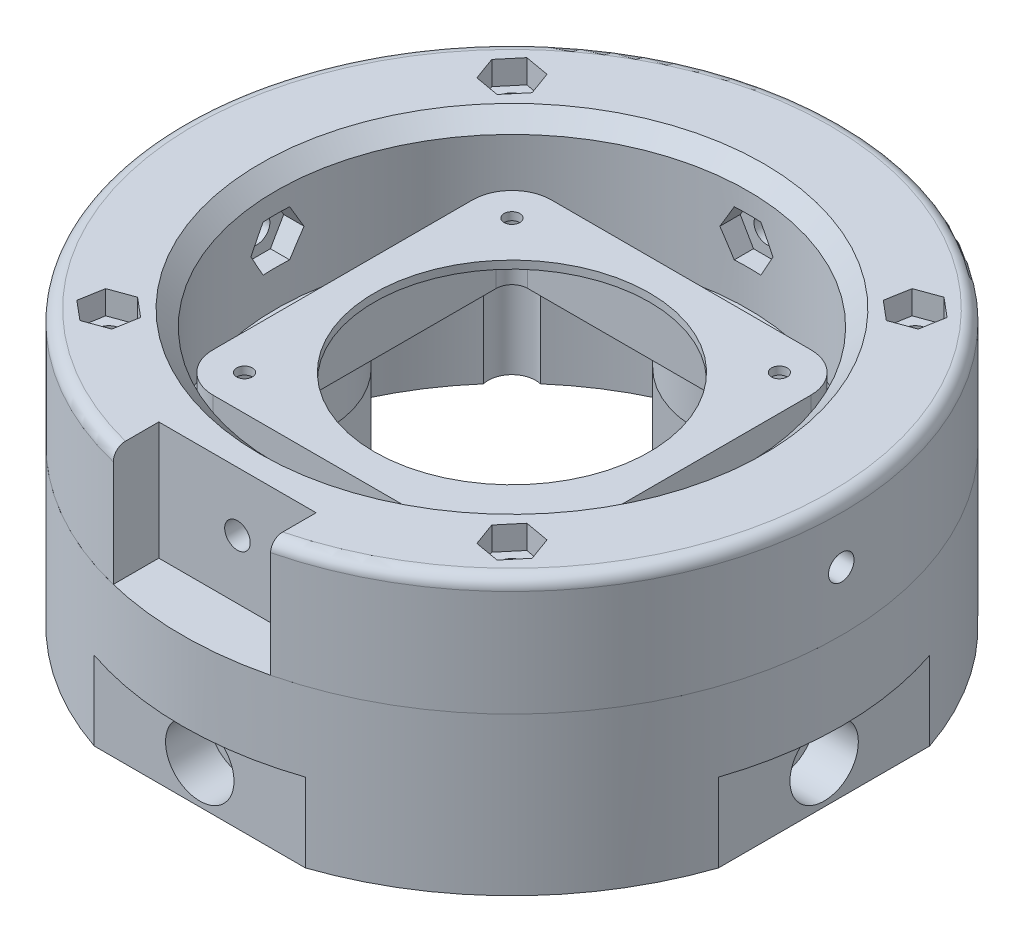
from build123d import *
from build123d.topology import SkipClean

# Parameters (mm, degrees)
SKETCH1_R               = 41.9
TOP_PART_DEPTH          = 15
SKETCH2_R               = 30
CUT_EXTRUDE1_DEPTH      = 20
FILLET1_R               = 1.5
CHAMFER1_SIZE           = 2
SKETCH8_7_R             = 1.625
CUT_EXTRUDE8_DEPTH      = 3
SKETCH8_R               = 1.625
CUT_EXTRUDE7_DEPTH      = 62.124626857
CUT_EXTRUDE11_DEPTH     = 62.124626857
SKETCH15_R              = 1.625
CUT_EXTRUDE14_DEPTH     = 10
CUT_EXTRUDE15_DEPTH     = 10
CIRPATTERN1_COUNT       = 4
CIRPATTERN2_COUNT       = 4
SKETCH3_R               = 41.9
BOTTOM_PART_DEPTH       = 20
SKETCH6_R               = 37.9
CUT_EXTRUDE3_DEPTH      = 63.076324134
SKETCH_1_W              = 43
SKETCH_1_H              = 43
EXTRUDE_1_DEPTH         = 8
FILLET_1_R              = 5
CUT_EXTRUDE4_DEPTH      = 63.076324134
CUT_EXTRUDE4_DEPTH_BACK = 63.076324134
SKETCH7_R               = 17.5
SKETCH7_R_2             = 1
SKETCH12_W              = 39.5
SKETCH12_H              = 39.5
CUT_EXTRUDE10_DEPTH     = 8.5
FILLET3_R               = 2
SKETCH17_R              = 1.625
CUT_EXTRUDE16_DEPTH     = 63.076324134
SKETCH18_R              = 3
CUT_EXTRUDE17_DEPTH     = 63.076324134
BOSS_EXTRUDE1_DEPTH     = 8.5
BOSS_EXTRUDE2_DEPTH     = 10
CUT_EXTRUDE18_DEPTH     = 10
SKETCH28_R              = 2.75
CUT_EXTRUDE19_DEPTH     = 13
SKETCH29_R              = 4.35
CUT_EXTRUDE20_DEPTH     = 5.5
CIRPATTERN3_COUNT       = 4
SKETCH30_W              = 20
SKETCH30_H              = 9.213516835
CUT_EXTRUDE21_DEPTH     = 15


with BuildPart() as part:
    # Sketch1 → Top-Part (new body)
    with BuildSketch(Plane(origin=(0, 0, 0), x_dir=(1, 0, 0), z_dir=(0, 1, 0))):
        with Locations(Location((0, 0, 0), (0, 0, 270))):
            Circle(SKETCH1_R)
    extrude(amount=TOP_PART_DEPTH)

    # Sketch2 → Cut-Extrude1 (cut)
    with BuildSketch(Plane(origin=(0, 15, 0), x_dir=(1, 0, 0), z_dir=(0, 1, 0))):
        with Locations(Location((0, 0, 0), (0, 0, 270))):
            Circle(SKETCH2_R)
    extrude(amount=-CUT_EXTRUDE1_DEPTH, mode=Mode.SUBTRACT)

    # Fillet1
    fillet1_edges = [part.edges().sort_by_distance(p)[0] for p in [
        (0, 15, -41.9),
    ]]
    fillet(fillet1_edges, radius=FILLET1_R)

    # Chamfer1
    chamfer1_edges = [part.edges().sort_by_distance(p)[0] for p in [
        (0, 15, -30),
    ]]
    chamfer(chamfer1_edges, length=CHAMFER1_SIZE)

    # Sketch8<7> → Cut-Extrude8 (cut)
    # profile 1 of 4: a face of its own
    with BuildSketch(Plane(origin=(0, 15, 0), x_dir=(1, 0, 0), z_dir=(0, 1, 0))):
        Polygon((25.083213555, 22.516777398), (28.056316743, 23.598898462), (28.605724005, 26.714741882), (26.182028081, 28.748464238), (23.208924893, 27.666343174), (22.659517631, 24.550499754), align=None)
        with Locations(Location((25.632620818, 25.632620818, 0), (0, 0, 270))):
            Circle(SKETCH8_7_R, mode=Mode.SUBTRACT)
    # profile 2 of 4: a face of its own
    with BuildSketch(Plane(origin=(0, 15, 0), x_dir=(1, 0, 0), z_dir=(0, 1, 0))):
        Polygon((-22.516777398, 25.083213555), (-23.598898462, 28.056316743), (-26.714741882, 28.605724005), (-28.748464238, 26.182028081), (-27.666343174, 23.208924893), (-24.550499754, 22.659517631), align=None)
        with Locations(Location((-25.632620818, 25.632620818, 0), (0, 0, 270))):
            Circle(SKETCH8_7_R, mode=Mode.SUBTRACT)
    # profile 3 of 4: a face of its own
    with BuildSketch(Plane(origin=(0, 15, 0), x_dir=(1, 0, 0), z_dir=(0, 1, 0))):
        Polygon((22.516777398, -25.083213555), (23.598898462, -28.056316743), (26.714741882, -28.605724005), (28.748464238, -26.182028081), (27.666343174, -23.208924893), (24.550499754, -22.659517631), align=None)
        with Locations(Location((25.632620818, -25.632620818, 0), (0, 0, 270))):
            Circle(SKETCH8_7_R, mode=Mode.SUBTRACT)
    # profile 4 of 4: a face of its own
    with BuildSketch(Plane(origin=(0, 15, 0), x_dir=(1, 0, 0), z_dir=(0, 1, 0))):
        Polygon((-25.083213555, -22.516777398), (-28.056316743, -23.598898462), (-28.605724005, -26.714741882), (-26.182028081, -28.748464238), (-23.208924893, -27.666343174), (-22.659517631, -24.550499754), align=None)
        with Locations(Location((-25.632620818, -25.632620818, 0), (0, 0, 270))):
            Circle(SKETCH8_7_R, mode=Mode.SUBTRACT)
    extrude(amount=-CUT_EXTRUDE8_DEPTH, mode=Mode.SUBTRACT)

    # Sketch8 → Cut-Extrude7 (cut, through all)
    with BuildSketch(Plane(origin=(0, 15, 0), x_dir=(1, 0, 0), z_dir=(0, 1, 0))):
        with Locations(Location((-25.632620818, 25.632620818, 0), (0, 0, 270))):
            Circle(SKETCH8_R)
        with Locations(Location((25.632620818, 25.632620818, 0), (0, 0, 270))):
            Circle(SKETCH8_R)
        with Locations(Location((25.632620818, -25.632620818, 0), (0, 0, 270))):
            Circle(SKETCH8_R)
        with Locations(Location((-25.632620818, -25.632620818, 0), (0, 0, 270))):
            Circle(SKETCH8_R)
    extrude(amount=-CUT_EXTRUDE7_DEPTH, mode=Mode.SUBTRACT)

    # Sketch13 → Cut-Extrude11 (cut, through all)
    with BuildSketch(Plane.XZ):
        with BuildLine():
            Line((-10, 35.519149765), (-10, 40.689187753))
            ThreePointArc((-10, 40.689187753), (0, 41.9), (10, 40.689187753))
            Line((10, 40.689187753), (10, 35.519149765))
            ThreePointArc((10, 35.519149765), (0, 36.9), (-10, 35.519149765))
        make_face()
    extrude(amount=-CUT_EXTRUDE11_DEPTH, mode=Mode.SUBTRACT)

    # Sketch15 → Cut-Extrude14 (cut, symmetric)
    with BuildSketch(Plane.XY.offset(32.4)):
        with Locations(Location((0, 7.5, 0), (0, 0, 180))):
            Circle(SKETCH15_R)
    cut_extrude14 = extrude(amount=CUT_EXTRUDE14_DEPTH, both=True, mode=Mode.SUBTRACT)

    # Sketch16 → Cut-Extrude15 (cut)
    with BuildSketch(Plane.XY.offset(32.4)):
        Polygon((3.377499075, 7.5), (1.688749537, 10.425), (-1.688749537, 10.425), (-3.377499075, 7.5), (-1.688749537, 4.575), (1.688749537, 4.575), align=None)
    cut_extrude15 = extrude(amount=-CUT_EXTRUDE15_DEPTH, mode=Mode.SUBTRACT)

    # CirPattern1: Cut-Extrude14 ×4 about axis
    cirpattern1_axis = Axis((0, 0, 0), (0, 1, 0))
    for i in range(1, CIRPATTERN1_COUNT):
        add(cut_extrude14.rotate(cirpattern1_axis, i * 360 / CIRPATTERN1_COUNT), mode=Mode.SUBTRACT)

    # CirPattern2: Cut-Extrude15 ×4 about axis
    cirpattern2_axis = Axis((0, 0, 0), (0, 1, 0))
    for i in range(1, CIRPATTERN2_COUNT):
        add(cut_extrude15.rotate(cirpattern2_axis, i * 360 / CIRPATTERN2_COUNT), mode=Mode.SUBTRACT)

    # Sketch30 → Cut-Extrude21 (cut)
    with BuildSketch(Plane(origin=(0, 15, 0), x_dir=(1, 0, 0), z_dir=(0, 1, 0))):
        with Locations((0, -39.506758418)):
            Rectangle(SKETCH30_W, SKETCH30_H)
    extrude(amount=-CUT_EXTRUDE21_DEPTH, mode=Mode.SUBTRACT)


with BuildPart() as body_2:
    # Sketch3 → Bottom-Part (new body)
    with BuildSketch(Plane.XZ):
        with Locations(Location((0, 0, 0), (0, 0, 270))):
            Circle(SKETCH3_R)
    extrude(amount=BOTTOM_PART_DEPTH)

    # Sketch6 → Cut-Extrude3 (cut, through all)
    with BuildSketch(Plane(origin=(0, -1.5, 0), x_dir=(1, 0, 0), z_dir=(0, 1, 0))):
        with Locations(Location((0, 0, 0), (0, 0, 270))):
            Circle(SKETCH6_R)
    extrude(amount=-CUT_EXTRUDE3_DEPTH, mode=Mode.SUBTRACT)

    # ｽｹｯﾁ1 → ﾎﾞｽ - 押し出し1 (add)
    with BuildSketch(Plane(origin=(0, 0, 0), x_dir=(1, 0, 0), z_dir=(0, 1, 0))):
        Rectangle(SKETCH_1_W, SKETCH_1_H)
    extrude(amount=EXTRUDE_1_DEPTH)

    # ﾌｨﾚｯﾄ1
    fillet_1_edges = [body_2.edges().sort_by_distance(p)[0] for p in [
        (-21.5, 4, -21.5),
        (-21.5, 4, 21.5),
        (21.5, 4, 21.5),
        (21.5, 4, -21.5),
    ]]
    fillet(fillet_1_edges, radius=FILLET_1_R)

    # Sketch7 → Cut-Extrude4 (cut, two sides: drawn at the far end of the back side and taken through both)
    with BuildSketch(Plane(origin=(0, -1.5, 0), x_dir=(1, 0, 0), z_dir=(0, 1, 0)).offset(-CUT_EXTRUDE4_DEPTH_BACK)):
        with Locations(Location((0, 0, 0), (0, 0, 270))):
            Circle(SKETCH7_R)
        with Locations(Location((17, -17, 0), (0, 0, 270))):
            Circle(SKETCH7_R_2)
        with Locations(Location((-17, -17, 0), (0, 0, 270))):
            Circle(SKETCH7_R_2)
        with Locations(Location((-17, 17, 0), (0, 0, 270))):
            Circle(SKETCH7_R_2)
        with Locations(Location((17, 17, 0), (0, 0, 270))):
            Circle(SKETCH7_R_2)
    extrude(amount=CUT_EXTRUDE4_DEPTH + CUT_EXTRUDE4_DEPTH_BACK, mode=Mode.SUBTRACT)

    # Sketch12 → Cut-Extrude10 (cut)
    with BuildSketch(Plane.XZ.offset(1.5)):
        Rectangle(SKETCH12_W, SKETCH12_H)
    extrude(amount=-CUT_EXTRUDE10_DEPTH, mode=Mode.SUBTRACT)

    # Fillet3
    fillet3_edges = [body_2.edges().sort_by_distance(p)[0] for p in [
        (-19.75, 2.75, -19.75),
        (-19.75, 2.75, 19.75),
        (19.75, 2.75, 19.75),
        (19.75, 2.75, -19.75),
    ]]
    fillet(fillet3_edges, radius=FILLET3_R)

    # Sketch17 → Cut-Extrude16 (cut, through all)
    with BuildSketch(Plane.XZ.offset(1.5)):
        with Locations(Location((25.632620818, -25.632620818, 0), (0, 0, 270))):
            Circle(SKETCH17_R)
        with Locations(Location((-25.632620818, -25.632620818, 0), (0, 0, 270))):
            Circle(SKETCH17_R)
        with Locations(Location((25.632620818, 25.632620818, 0), (0, 0, 270))):
            Circle(SKETCH17_R)
        with Locations(Location((-25.632620818, 25.632620818, 0), (0, 0, 270))):
            Circle(SKETCH17_R)
    extrude(amount=-CUT_EXTRUDE16_DEPTH, mode=Mode.SUBTRACT)

    # Sketch18 → Cut-Extrude17 (cut, through all)
    with BuildSketch(Plane.XZ.offset(1.5)):
        with Locations((-25.632620818, 25.632620818)):
            Circle(SKETCH18_R)
        with Locations((25.632620818, 25.632620818)):
            Circle(SKETCH18_R)
        with Locations((25.632620818, -25.632620818)):
            Circle(SKETCH18_R)
        with Locations((-25.632620818, -25.632620818)):
            Circle(SKETCH18_R)
    extrude(amount=CUT_EXTRUDE17_DEPTH, mode=Mode.SUBTRACT)

    # Sketch19 → Boss-Extrude1 (add)
    with BuildSketch(Plane.XZ.offset(1.5)):
        with BuildLine():
            ThreePointArc((35.44337475, 13.423009585), (23.487033321, 0), (35.44337475, -13.423009585))
            ThreePointArc((35.44337475, -13.423009585), (37.9, 0), (35.44337475, 13.423009585))
        make_face()
        with BuildLine():
            ThreePointArc((-13.423009585, 35.44337475), (0, 23.487033321), (13.423009585, 35.44337475))
            ThreePointArc((13.423009585, 35.44337475), (0, 37.9), (-13.423009585, 35.44337475))
        make_face()
        with BuildLine():
            ThreePointArc((13.423009585, -35.44337475), (0, -23.487033321), (-13.423009585, -35.44337475))
            ThreePointArc((-13.423009585, -35.44337475), (0, -37.9), (13.423009585, -35.44337475))
        make_face()
        with BuildLine():
            ThreePointArc((-35.44337475, -13.423009585), (-23.487033321, 0), (-35.44337475, 13.423009585))
            ThreePointArc((-35.44337475, 13.423009585), (-37.9, 0), (-35.44337475, -13.423009585))
        make_face()
    extrude(amount=BOSS_EXTRUDE1_DEPTH)

    # Sketch23 → Boss-Extrude2 (add)
    with SkipClean():  # the faces are left unmerged after this step: merging them gives an invalid solid
        with BuildSketch(Plane.XZ.offset(10)):
            with BuildLine():
                Line((9.707742708, -27.6), (-9.707742708, -27.6))
                ThreePointArc((-9.707742708, -27.6), (-12.212188881, -31.215303707), (-13.423009585, -35.44337475))
                ThreePointArc((-13.423009585, -35.44337475), (0, -37.9), (13.423009585, -35.44337475))
                ThreePointArc((13.423009585, -35.44337475), (12.212188881, -31.215303707), (9.707742708, -27.6))
            make_face()
            with BuildLine():
                Line((27.6, -9.707742708), (27.6, 9.707742708))
                ThreePointArc((27.6, 9.707742708), (31.215303707, 12.212188881), (35.44337475, 13.423009585))
                ThreePointArc((35.44337475, 13.423009585), (37.9, 0), (35.44337475, -13.423009585))
                ThreePointArc((35.44337475, -13.423009585), (31.215303707, -12.212188881), (27.6, -9.707742708))
            make_face()
            with BuildLine():
                Line((9.707742708, 27.6), (-9.707742708, 27.6))
                ThreePointArc((-9.707742708, 27.6), (-12.212188881, 31.215303707), (-13.423009585, 35.44337475))
                ThreePointArc((-13.423009585, 35.44337475), (0, 37.9), (13.423009585, 35.44337475))
                ThreePointArc((13.423009585, 35.44337475), (12.212188881, 31.215303707), (9.707742708, 27.6))
            make_face()
            with BuildLine():
                Line((-27.6, -9.707742708), (-27.6, 9.707742708))
                ThreePointArc((-27.6, 9.707742708), (-31.215303707, 12.212188881), (-35.44337475, 13.423009585))
                ThreePointArc((-35.44337475, 13.423009585), (-37.9, 0), (-35.44337475, -13.423009585))
                ThreePointArc((-35.44337475, -13.423009585), (-31.215303707, -12.212188881), (-27.6, -9.707742708))
            make_face()
        extrude(amount=BOSS_EXTRUDE2_DEPTH)

    # Sketch27 → Cut-Extrude18 (cut)
    with SkipClean():  # the faces are left unmerged after this step: merging them gives an invalid solid
        with BuildSketch(Plane.XZ.offset(20)):
            with BuildLine():
                Line((39.691722231, 13.423009585), (39.691722231, -13.423009585))
                ThreePointArc((39.691722231, -13.423009585), (41.9, 0), (39.691722231, 13.423009585))
            make_face()
            with BuildLine():
                Line((-13.423009585, 39.691722231), (13.423009585, 39.691722231))
                ThreePointArc((13.423009585, 39.691722231), (0, 41.9), (-13.423009585, 39.691722231))
            make_face()
            with BuildLine():
                Line((13.423009585, -39.691722231), (-13.423009585, -39.691722231))
                ThreePointArc((-13.423009585, -39.691722231), (0, -41.9), (13.423009585, -39.691722231))
            make_face()
            with BuildLine():
                Line((-39.691722231, -13.423009585), (-39.691722231, 13.423009585))
                ThreePointArc((-39.691722231, 13.423009585), (-41.9, 0), (-39.691722231, -13.423009585))
            make_face()
        extrude(amount=-CUT_EXTRUDE18_DEPTH, mode=Mode.SUBTRACT)

    # Sketch28 → Cut-Extrude19 (cut)
    with SkipClean():  # the faces are left unmerged after this step: merging them gives an invalid solid
        with BuildSketch(Plane.XY.offset(39.691722231)):
            with Locations((0, -15)):
                Circle(SKETCH28_R)
        cut_extrude19 = extrude(amount=-CUT_EXTRUDE19_DEPTH, mode=Mode.SUBTRACT)

    # Sketch29 → Cut-Extrude20 (cut)
    with SkipClean():  # the faces are left unmerged after this step: merging them gives an invalid solid
        with BuildSketch(Plane.XY.offset(39.691722231)):
            with Locations((0, -15)):
                Circle(SKETCH29_R)
        cut_extrude20 = extrude(amount=-CUT_EXTRUDE20_DEPTH, mode=Mode.SUBTRACT)

    # CirPattern3: Cut-Extrude19, Cut-Extrude20 ×4 about axis
    with SkipClean():  # the faces are left unmerged after this step: merging them gives an invalid solid
        cirpattern3_axis = Axis((0, 0, 0), (0, 1, 0))
        add([cut_extrude19.rotate(cirpattern3_axis, i * 360 / CIRPATTERN3_COUNT) for i in range(1, CIRPATTERN3_COUNT)], mode=Mode.SUBTRACT)
        add([cut_extrude20.rotate(cirpattern3_axis, i * 360 / CIRPATTERN3_COUNT) for i in range(1, CIRPATTERN3_COUNT)], mode=Mode.SUBTRACT)


solid = Compound([part.part, body_2.part])
